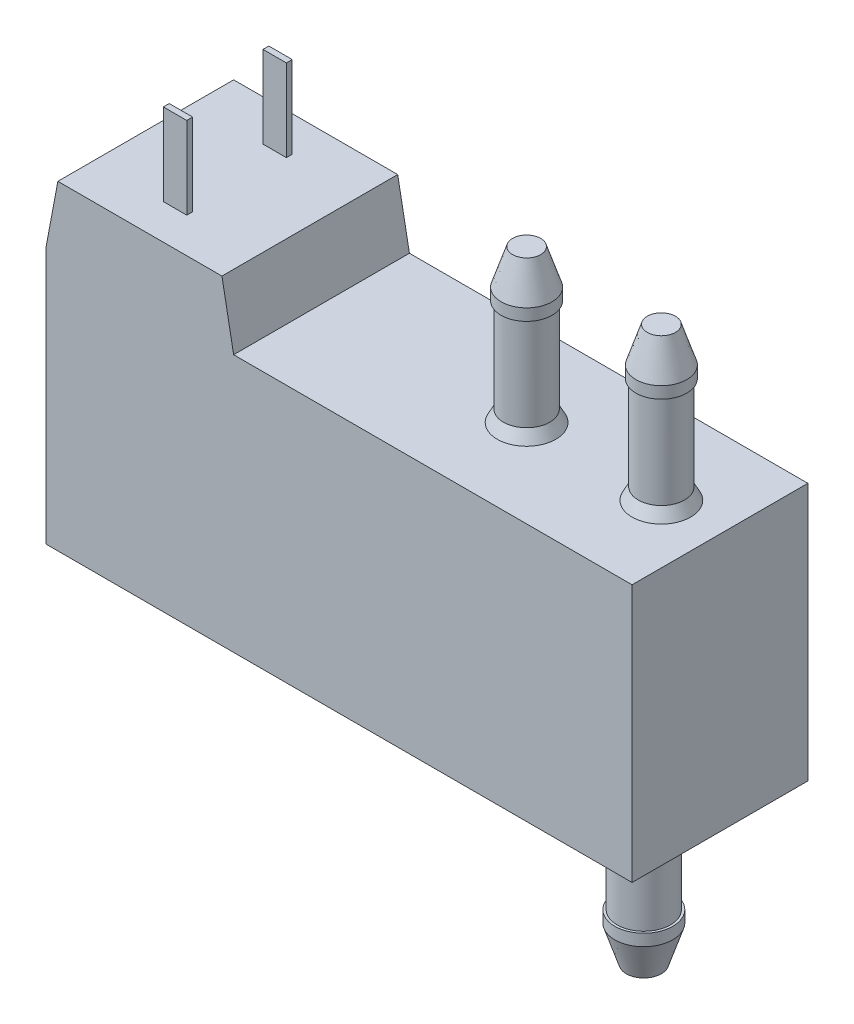
from build123d import *

# Parameters (mm, degrees)
SKETCH1_W                       = 50
SKETCH1_H                       = 22
BOSS_EXTRUDE1_DEPTH             = 7.5
BOSS_EXTRUDE3_REACH             = 30.324
BOSS_EXTRUDE3_DIRECTION_2_REACH = 30.324
SKETCH9_W                       = 2
SKETCH9_H                       = 0.5
BOSS_EXTRUDE4_DEPTH             = 7


with BuildPart() as part:
    # Sketch1 → Boss-Extrude1 (new, symmetric)
    with BuildSketch(Plane.XY):
        Rectangle(SKETCH1_W, SKETCH1_H)
    extrude(amount=BOSS_EXTRUDE1_DEPTH, both=True)

    # Boss-Extrude3: up to this face of the body (flat: up to its plane)
    boss_extrude3_end = Plane(part.part.faces().sort_by_distance((0, 0, 7.5))[0])
    # Sketch3 → Boss-Extrude3 (add, up to the picked face)
    with BuildSketch(Plane.XY, mode=Mode.PRIVATE) as boss_extrude3_sk1:
        Polygon((-25, 11), (-24, 16.31597155), (-10, 16.31597155), (-9, 11), align=None)
    boss_extrude3_tool1 = split(extrude(boss_extrude3_sk1.sketch, amount=BOSS_EXTRUDE3_REACH, mode=Mode.PRIVATE), bisect_by=boss_extrude3_end, keep=Keep.BOTH, mode=Mode.PRIVATE)
    add(boss_extrude3_tool1.solids().sort_by(Axis((-17, 13.598919, 0), (0, 0, 1)))[0])

    # Boss-Extrude3 direction 2: up to this face of the body (flat: up to its plane)
    boss_extrude3_direction_2_end = Plane(part.part.faces().sort_by_distance((0, 0, -7.5))[0])
    # Sketch3 → Boss-Extrude3 direction 2 (add, up to the picked face)
    with BuildSketch(Plane.XY, mode=Mode.PRIVATE) as boss_extrude3_direction_2_sk1:
        Polygon((-25, 11), (-24, 16.31597155), (-10, 16.31597155), (-9, 11), align=None)
    boss_extrude3_direction_2_tool1 = split(extrude(boss_extrude3_direction_2_sk1.sketch, amount=-BOSS_EXTRUDE3_DIRECTION_2_REACH, mode=Mode.PRIVATE), bisect_by=boss_extrude3_direction_2_end, keep=Keep.BOTH, mode=Mode.PRIVATE)
    add(boss_extrude3_direction_2_tool1.solids().sort_by(Axis((-17, 13.598919, 0), (0, 0, -1)))[0])

    # Sketch5 → Revolve1 (revolve)
    with BuildSketch(Plane.XY):
        Polygon((8.5, 11), (11, 11), (10.474759089, 12), (10.474759089, 20), (10.674759089, 20), (10.674759089, 21), (9.7, 24), (8.5, 24), align=None)
    revolve(axis=Axis((8.5, 24, 0), (0, -1, 0)))

    # Sketch6 → Revolve2 (revolve)
    with BuildSketch(Plane.XY):
        Polygon((20, 11), (22.5, 11), (21.974759089, 12), (21.974759089, 20), (22.174759089, 20), (22.174759089, 21), (21.2, 24), (20, 24), align=None)
    revolve(axis=Axis((20, 24, 0), (0, -1, 0)))

    # Sketch8 → Revolve3 (revolve)
    with BuildSketch(Plane.XY):
        Polygon((18.5, -11), (18.5, -24), (17, -24), (16.025240911, -21), (16.025240911, -20), (16.225240911, -20), (16.225240911, -12), (16, -11), align=None)
    revolve(axis=Axis((18.5, -11, 0), (0, -1, 0)))

    # Sketch9 → Boss-Extrude4 (add)
    with BuildSketch(Plane(origin=(0, 16.31597155, 0), x_dir=(1, 0, 0), z_dir=(0, 1, 0))):
        with Locations((-17, 4.25)):
            Rectangle(SKETCH9_W, SKETCH9_H)
    boss_extrude4 = extrude(amount=BOSS_EXTRUDE4_DEPTH)

    # Mirror1: Boss-Extrude4 across plane
    add(boss_extrude4.mirror(Plane.XY))


solid = part.part
